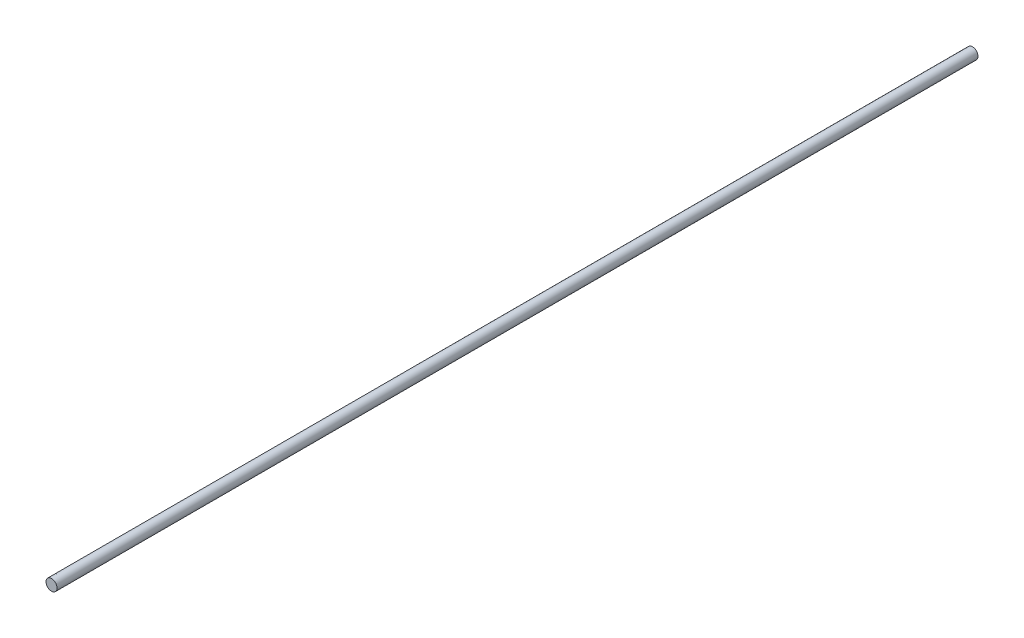
from build123d import *

# Parameters (mm, degrees)
SKETCH1_R           = 3
BOSS_EXTRUDE1_DEPTH = 250


with BuildPart() as part:
    # Sketch1 → Boss-Extrude1 (new, symmetric)
    with BuildSketch(Plane.XY):
        Circle(SKETCH1_R)
    extrude(amount=BOSS_EXTRUDE1_DEPTH, both=True)


solid = part.part
